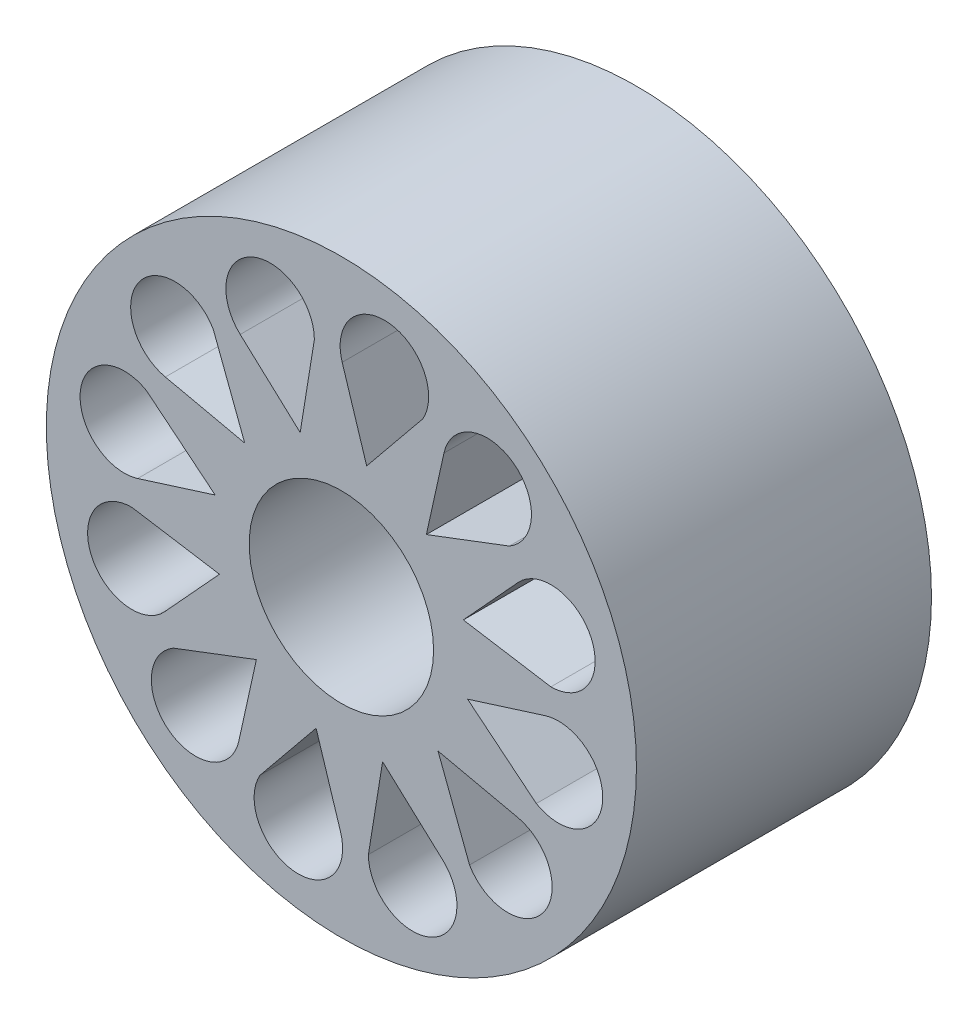
from build123d import *

# Parameters (mm, degrees)
SKETCH1_R           = 12.7
SKETCH1_R_2         = 3.96875
BOSS_EXTRUDE1_DEPTH = 12.7
CUT_EXTRUDE1_DEPTH  = 22.997045256
CIRPATTERN1_COUNT   = 12


with BuildPart() as part:
    # Sketch1 → Boss-Extrude1 (new body)
    with BuildSketch(Plane.XY):
        Circle(SKETCH1_R)
        Circle(SKETCH1_R_2, mode=Mode.SUBTRACT)
    extrude(amount=BOSS_EXTRUDE1_DEPTH)

    # Sketch2 → Cut-Extrude1 (cut, through all)
    with BuildSketch(Plane.XY.offset(12.7)):
        with BuildLine():
            Line((-4.354775644, 7.61249898), (-1.77319664, 5.248090699))
            Line((-1.77319664, 5.248090699), (-1.260387004, 8.416402273))
            Line((-1.260387004, 8.416402273), (-1.163123324, 9.017330218))
            ThreePointArc((-1.163123324, 9.017330218), (-3.83557115, 10.7609038), (-4.354775644, 7.61249898))
        make_face()
    cut_extrude1 = extrude(amount=-CUT_EXTRUDE1_DEPTH, mode=Mode.SUBTRACT)

    # CirPattern1: Cut-Extrude1 ×12 about axis
    cirpattern1_axis = Axis((0, 0, 0), (0, 0, 1))
    for i in range(1, CIRPATTERN1_COUNT):
        add(cut_extrude1.rotate(cirpattern1_axis, i * 360 / CIRPATTERN1_COUNT), mode=Mode.SUBTRACT)


solid = part.part
